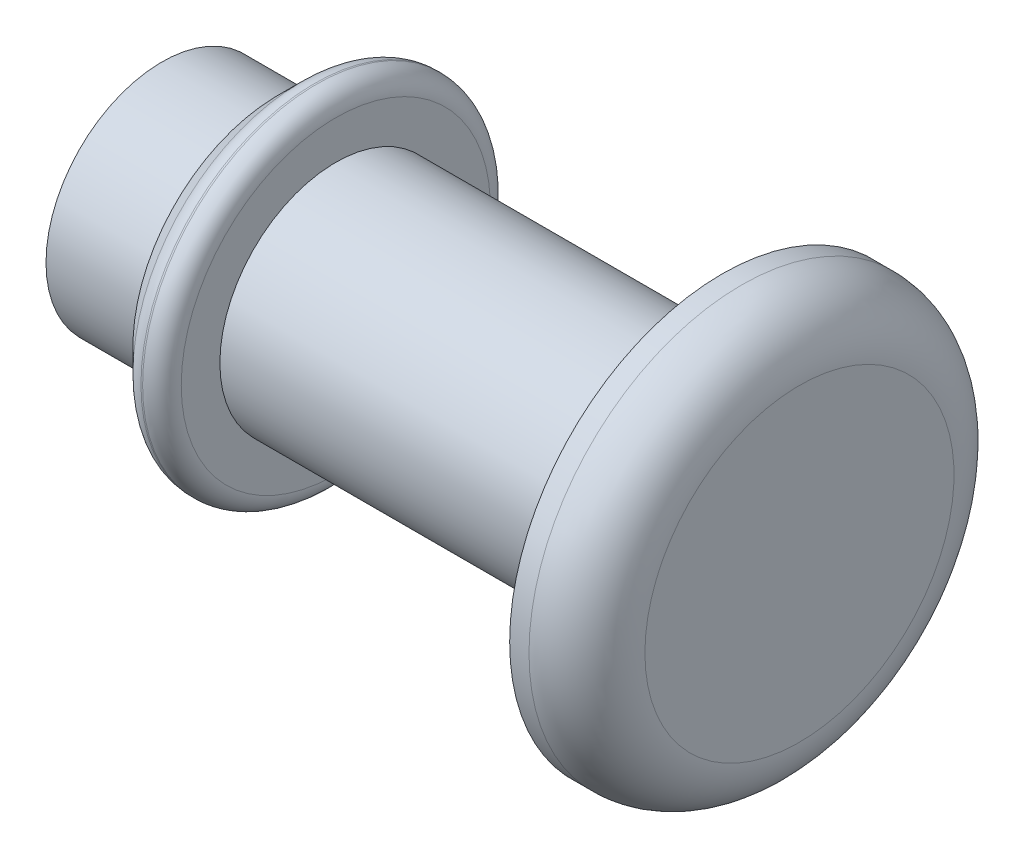
from build123d import *

# Parameters (mm, degrees)
FILLET1_R     = 1.5
CHAMFER1_SIZE = 0.75
FILLET2_R     = 0.5


with BuildPart() as part:
    # Sketch2 → Revolve1 (revolve)
    with BuildSketch(Plane.XY, mode=Mode.PRIVATE) as revolve1_sk:
        Polygon((0, 0), (0, 5.5), (-2, 5.5), (-2, 3), (-12, 3), (-12, 4.5), (-13.5, 4.5), (-13.5, 3), (-16.5, 3), (-16.5, 0), align=None)
    revolve(revolve1_sk.sketch.rotate(Axis((-42.300017882, 0, 0), (1, 0, 0)), 90), axis=Axis((-42.300017882, 0, 0), (1, 0, 0)))

    # Fillet1
    fillet1_edges = [part.edges().sort_by_distance(p)[0] for p in [
        (0, 0, -5.5),
    ]]
    fillet(fillet1_edges, radius=FILLET1_R)

    # Chamfer1
    chamfer1_edges = [part.edges().sort_by_distance(p)[0] for p in [
        (-13.5, 0, -4.5),
    ]]
    chamfer(chamfer1_edges, length=CHAMFER1_SIZE)

    # Fillet2
    fillet2_edges = [part.edges().sort_by_distance(p)[0] for p in [
        (-12.75, 0, -4.5),
        (-12, 0, -4.5),
    ]]
    fillet(fillet2_edges, radius=FILLET2_R)


solid = part.part
